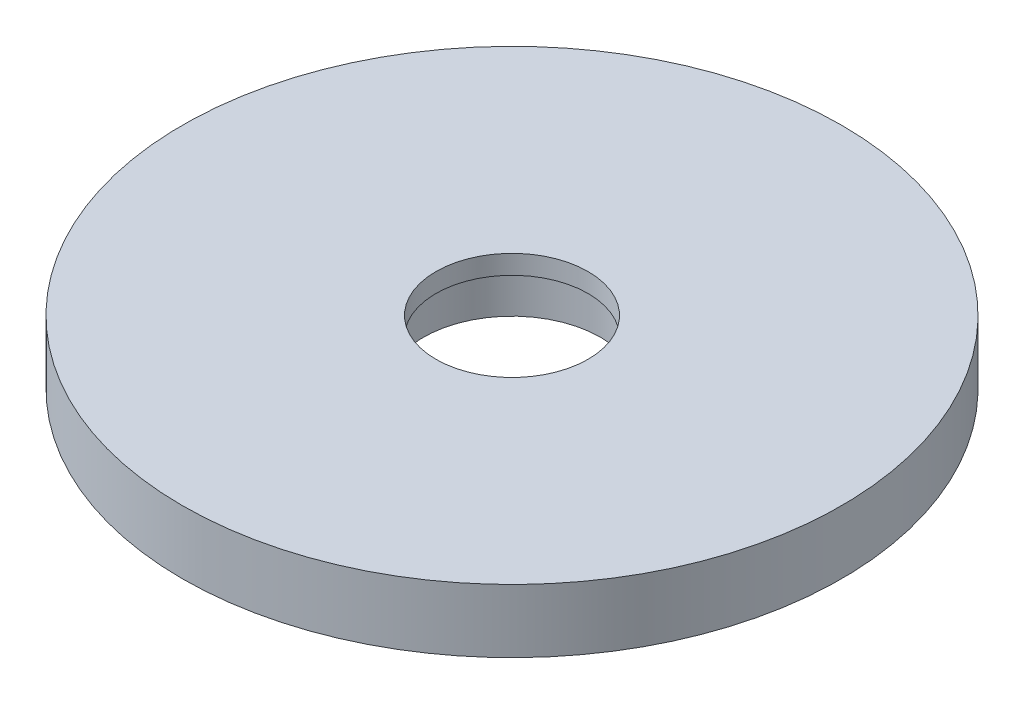
from build123d import *

# Parameters (mm, degrees)
SKETCH1_R           = 52
BOSS_EXTRUDE1_DEPTH = 10
SKETCH2_R           = 50
CUT_EXTRUDE4_DEPTH  = 5
SKETCH3_R           = 12
CUT_EXTRUDE7_DEPTH  = 10
SKETCH4_R           = 17
BOSS_EXTRUDE2_DEPTH = 5
SKETCH5_R           = 14
CUT_EXTRUDE8_DEPTH  = 7


with BuildPart() as part:
    # Sketch1 → Boss-Extrude1 (new body)
    with BuildSketch(Plane(origin=(0, 0, 0), x_dir=(1, 0, 0), z_dir=(0, 1, 0))):
        with Locations(Location((0, 0, 0), (0, 0, 270))):
            Circle(SKETCH1_R)
    extrude(amount=BOSS_EXTRUDE1_DEPTH)

    # Sketch2 → Cut-Extrude4 (cut)
    with BuildSketch(Plane(origin=(0, 0, 0), x_dir=(1, 0, 0), z_dir=(0, 1, 0))):
        with Locations(Location((0, 0, 0), (0, 0, 270))):
            Circle(SKETCH2_R)
    extrude(amount=CUT_EXTRUDE4_DEPTH, mode=Mode.SUBTRACT)

    # Sketch3 → Cut-Extrude7 (cut)
    with BuildSketch(Plane(origin=(0, 0, 0), x_dir=(1, 0, 0), z_dir=(0, 1, 0))):
        with Locations(Location((0, 0, 0), (0, 0, 270))):
            Circle(SKETCH3_R)
    extrude(amount=CUT_EXTRUDE7_DEPTH, mode=Mode.SUBTRACT)

    # Sketch4 → Boss-Extrude2 (add)
    with BuildSketch(Plane.XZ.offset(-5)):
        with Locations(Location((0, 0, 0), (0, 0, 90))):
            Circle(SKETCH4_R)
    extrude(amount=BOSS_EXTRUDE2_DEPTH)

    # Sketch5 → Cut-Extrude8 (cut)
    with BuildSketch(Plane.XZ):
        with Locations(Location((0, 0, 0), (0, 0, 270))):
            Circle(SKETCH5_R)
    extrude(amount=-CUT_EXTRUDE8_DEPTH, mode=Mode.SUBTRACT)


solid = part.part
